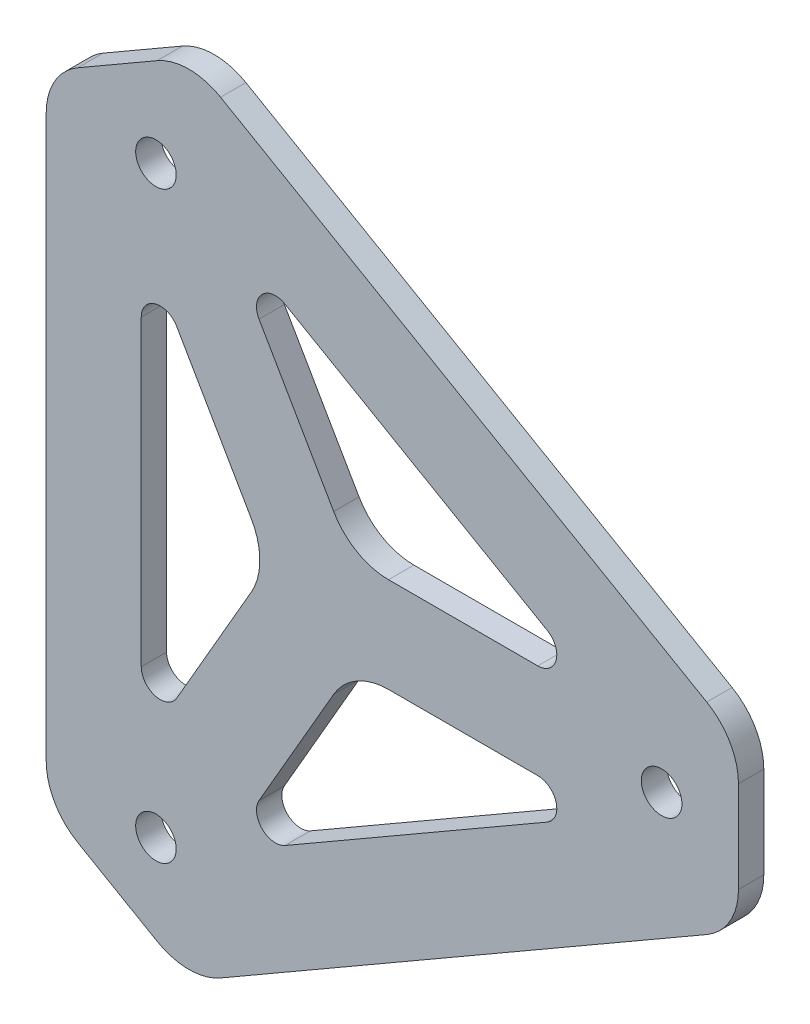
from build123d import *

# Parameters (mm, degrees)
SKETCH_1_R          = 1.6
EXTRUDE_1_DEPTH     = 2
CUT_EXTRUDE_1_DEPTH = 10
FILLET_1_R          = 5
FILLET_2_R          = 1.5


with BuildPart() as part:
    # ｽｹｯﾁ1 → ﾎﾞｽ - 押し出し1 (new body)
    with BuildSketch(Plane.XY):
        Polygon((-10.703193979, 31.538475775), (-21.961524228, 25.038475775), (-21.961524228, -25.038475775), (-10.703193979, -31.538475775), (32.664718207, -6.5), (32.664718207, 6.5), align=None)
        with Locations((-13.30127019, 23.038475775)):
            Circle(SKETCH_1_R, mode=Mode.SUBTRACT)
        with Locations((-13.30127019, -23.038475775)):
            Circle(SKETCH_1_R, mode=Mode.SUBTRACT)
        with Locations((26.602540381, 0)):
            Circle(SKETCH_1_R, mode=Mode.SUBTRACT)
    extrude(amount=EXTRUDE_1_DEPTH)

    # ｽｹｯﾁ2 → ｶｯﾄ - 押し出し1 (cut)
    with BuildSketch(Plane.XY.offset(2)):
        Polygon((-4.330127019, 0), (-14.461524228, 17.548094718), (-14.461524228, -17.548094718), align=None)
        Polygon((2.165063509, -3.75), (-7.9663337, -21.298094718), (22.427857928, -3.75), align=None)
        Polygon((22.427857928, 3.75), (-7.9663337, 21.298094718), (2.165063509, 3.75), align=None)
    extrude(amount=-CUT_EXTRUDE_1_DEPTH, mode=Mode.SUBTRACT)

    # ﾌｨﾚｯﾄ1
    fillet_1_edges = [part.edges().sort_by_distance(p)[0] for p in [
        (32.664718207, 6.5, 1),
        (32.664718207, -6.5, 1),
        (-10.703193979, -31.538475775, 1),
        (-21.961524228, -25.038475775, 1),
        (-21.961524228, 25.038475775, 1),
        (-10.703193979, 31.538475775, 1),
        (-4.330127019, 0, 1),
        (2.165063509, -3.75, 1),
        (2.165063509, 3.75, 1),
    ]]
    fillet(fillet_1_edges, radius=FILLET_1_R)

    # ﾌｨﾚｯﾄ2
    fillet_2_edges = [part.edges().sort_by_distance(p)[0] for p in [
        (-14.461524228, 17.548094718, 1),
        (-14.461524228, -17.548094718, 1),
        (22.427857928, -3.75, 1),
        (-7.9663337, -21.298094718, 1),
        (-7.9663337, 21.298094718, 1),
        (22.427857928, 3.75, 1),
    ]]
    fillet(fillet_2_edges, radius=FILLET_2_R)


solid = part.part
